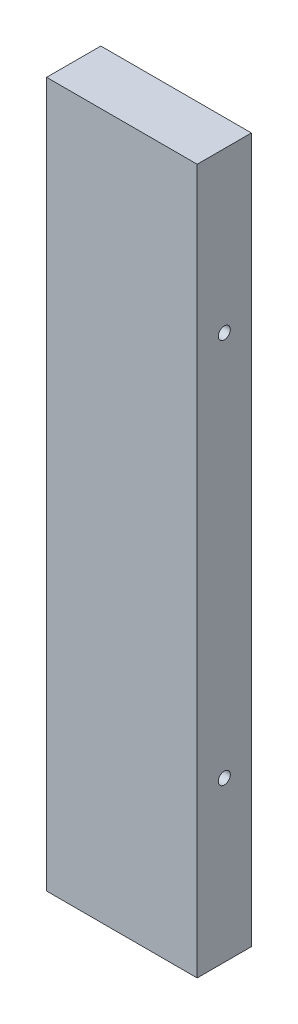
from build123d import *

# Parameters (mm, degrees)
SKETCH1_W                    = 50
SKETCH1_H                    = 234
BOSS_EXTRUDE1_DEPTH          = 18
F_4_0_4_DIAMETER_HOLE2_D     = 4
F_4_0_4_DIAMETER_HOLE2_DEPTH = 30
F_4_0_4_DIAMETER_HOLE2_TIP   = 1.201721238
F_4_0_4_DIAMETER_HOLE3_D     = 4
F_4_0_4_DIAMETER_HOLE3_DEPTH = 30
F_4_0_4_DIAMETER_HOLE3_TIP   = 1.201721238


with BuildPart() as part:
    # Sketch1 → Boss-Extrude1 (new body)
    with BuildSketch(Plane.XY):
        Rectangle(SKETCH1_W, SKETCH1_H)
    extrude(amount=BOSS_EXTRUDE1_DEPTH)

    # Ø4.0 (4) Diameter Hole2
    with Locations(Plane(origin=(25, 0, 0), x_dir=(0, 0, -1), z_dir=(1, 0, 0))):
        with Locations((-9, 64), (-9, -64)):
            Hole(F_4_0_4_DIAMETER_HOLE2_D / 2, depth=F_4_0_4_DIAMETER_HOLE2_DEPTH)
            with Locations((0, 0, -(F_4_0_4_DIAMETER_HOLE2_DEPTH + F_4_0_4_DIAMETER_HOLE2_TIP / 2))):  # 118° drill point
                Cone(0, F_4_0_4_DIAMETER_HOLE2_D / 2, F_4_0_4_DIAMETER_HOLE2_TIP, mode=Mode.SUBTRACT)

    # Ø4.0 (4) Diameter Hole3
    with Locations(Plane.ZY.offset(25)):
        with Locations((9, 85), (9, 0), (9, -85)):
            Hole(F_4_0_4_DIAMETER_HOLE3_D / 2, depth=F_4_0_4_DIAMETER_HOLE3_DEPTH)
            with Locations((0, 0, -(F_4_0_4_DIAMETER_HOLE3_DEPTH + F_4_0_4_DIAMETER_HOLE3_TIP / 2))):  # 118° drill point
                Cone(0, F_4_0_4_DIAMETER_HOLE3_D / 2, F_4_0_4_DIAMETER_HOLE3_TIP, mode=Mode.SUBTRACT)


solid = part.part
